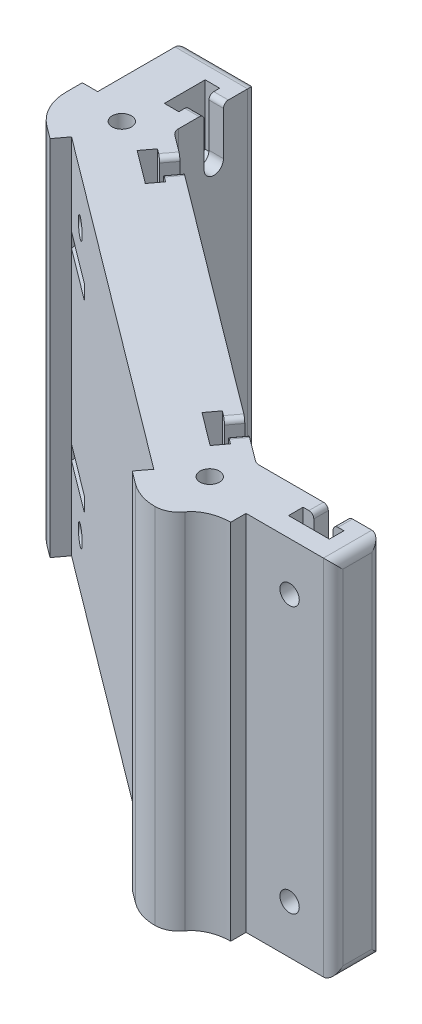
from build123d import *

# Parameters (mm, degrees)
BOSS_EXTRUDE1_DEPTH = 75
SKETCH2_R           = 2
CUT_EXTRUDE1_DEPTH  = 10
SKETCH3_R           = 2
CUT_EXTRUDE2_DEPTH  = 15
SKETCH4_R           = 2
CUT_EXTRUDE3_DEPTH  = 15
CUT_EXTRUDE5_START  = -3
CUT_EXTRUDE5_DEPTH  = 3
CUT_EXTRUDE6_START  = -3
CUT_EXTRUDE6_DEPTH  = 3
CUT_EXTRUDE7_START  = -3
CUT_EXTRUDE7_DEPTH  = 3
CUT_EXTRUDE8_START  = -3
CUT_EXTRUDE8_DEPTH  = 3
CUT_EXTRUDE9_START  = -3
CUT_EXTRUDE9_DEPTH  = 3
SKETCH5_R           = 2
CUT_EXTRUDE4_DEPTH  = 75
CUT_EXTRUDE10_START = -3
CUT_EXTRUDE10_DEPTH = 3
FILLET1_R           = 1
FILLET2_R           = 2
CUT_EXTRUDE11_START = -17
CUT_EXTRUDE11_DEPTH = 3


with BuildPart() as part:
    # Sketch1 → Boss-Extrude1 (new body)
    with BuildSketch(Plane(origin=(0, 0, 0), x_dir=(1, 0, 0), z_dir=(0, 1, 0))):
        with BuildLine():
            Line((-18.028333333, 23.74), (2.725, 8.175))
            Line((2.725, 8.175), (28.666666667, 8.175))
            Line((28.666666667, 8.175), (28.666666667, -1.825))
            Line((28.666666667, -1.825), (10.666666667, -1.825))
            Line((10.666666667, -1.825), (10.666666667, -5))
            add(Edge.make_bspline(
                [(10.666666667, -5), (6.082964765, -5), (4.109838042, -7.8476712)],
                knots=[4.71238898, 4.71238898, 4.71238898, 5.838176577, 5.838176577, 5.838176577], degree=2, weights=[1, 0.84571442, 1]))
            ThreePointArc((4.109838042, -7.8476712), (2.319659889, -9.429354129), (0, -10))
            ThreePointArc((0, -10), (-3.16227766, -9.486832981), (-6, -8))
            Line((-6, -8), (-8.666666667, -6))
            Line((-8.666666667, -6), (-6.761666667, -3.46))
            Line((-6.761666667, -3.46), (-74.761666667, 47.54))
            Line((-74.761666667, 47.54), (-76.666666667, 45))
            Line((-76.666666667, 45), (-79.333333333, 47))
            ThreePointArc((-79.333333333, 47), (-82.277605243, 50.527864045), (-83.333333333, 55))
            Line((-83.333333333, 55), (-83.333333333, 58.333333333))
            Line((-83.333333333, 58.333333333), (-80.158333333, 58.333333333))
            Line((-80.158333333, 58.333333333), (-80.158333333, 76.333333333))
            Line((-80.158333333, 76.333333333), (-65.158333333, 76.333333333))
            Line((-65.158333333, 76.333333333), (-65.158333333, 59.0875))
            Line((-65.158333333, 59.0875), (-51.361666667, 48.74))
            Line((-51.361666667, 48.74), (-18.028333333, 23.74))
        make_face()
    extrude(amount=BOSS_EXTRUDE1_DEPTH)

    # Sketch2 → Cut-Extrude1 (cut)
    with BuildSketch(Plane.XY.offset(1.825)):
        with Locations((19.666666667, 10)):
            Circle(SKETCH2_R)
        with Locations((19.666666667, 65)):
            Circle(SKETCH2_R)
    extrude(amount=-CUT_EXTRUDE1_DEPTH, mode=Mode.SUBTRACT)

    # Sketch3 → Cut-Extrude2 (cut)
    with BuildSketch(Plane(origin=(-4.095, 0, 5.46), x_dir=(0.8000000000000002, 0, 0.5999999999999999), z_dir=(-0.5999999999999999, 0, 0.8000000000000003))):
        with Locations((-12.333333333, 10)):
            Circle(SKETCH3_R)
        with Locations((-12.333333333, 65)):
            Circle(SKETCH3_R)
        with Locations((-79.333333333, 10)):
            Circle(SKETCH3_R)
        with Locations((-79.333333333, 65)):
            Circle(SKETCH3_R)
    extrude(amount=-CUT_EXTRUDE2_DEPTH, mode=Mode.SUBTRACT)

    # Sketch4 → Cut-Extrude3 (cut)
    with BuildSketch(Plane.ZY.offset(80.158333333)):
        with Locations((-67.333333333, 10)):
            Circle(SKETCH4_R)
        with Locations((-67.333333333, 65)):
            Circle(SKETCH4_R)
    extrude(amount=-CUT_EXTRUDE3_DEPTH, mode=Mode.SUBTRACT)

    # Sketch6 → Cut-Extrude5 (cut)
    with BuildSketch(Plane(origin=(4.905, 0, -6.54), x_dir=(-0.8000000000000002, 0, -0.6), z_dir=(0.6, 0, -0.8000000000000002)).offset(CUT_EXTRUDE5_START)):
        Polygon((8.114583333, 62.564303552), (12.333333333, 60.128607104), (16.552083333, 62.564303552), (16.552083333, 75), (8.114583333, 75), align=None)
        Polygon((75.114583333, 62.564303552), (79.333333333, 60.128607104), (83.552083333, 62.564303552), (83.552083333, 75), (75.114583333, 75), align=None)
        Polygon((8.114583333, 12.435696448), (12.333333333, 14.871392896), (16.552083333, 12.435696448), (16.552083333, 0), (8.114583333, 0), align=None)
        Polygon((75.114583333, 12.435696448), (79.333333333, 14.871392896), (83.552083333, 12.435696448), (83.552083333, 0), (75.114583333, 0), align=None)
    extrude(amount=-CUT_EXTRUDE5_DEPTH, mode=Mode.SUBTRACT)

    # Sketch7 → Cut-Extrude6 (cut)
    with BuildSketch(Plane(origin=(4.905, 0, -6.54), x_dir=(-0.8000000000000002, 0, -0.6), z_dir=(0.6, 0, -0.8000000000000002)).offset(CUT_EXTRUDE6_START)):
        with BuildLine():
            Line((14.333333333, 65), (14.333333333, 75))
            Line((14.333333333, 75), (10.333333333, 75))
            Line((10.333333333, 75), (10.333333333, 65))
            ThreePointArc((10.333333333, 65), (12.333333333, 67), (14.333333333, 65))
        make_face()
        with BuildLine():
            Line((81.333333333, 65), (81.333333333, 75))
            Line((81.333333333, 75), (77.333333333, 75))
            Line((77.333333333, 75), (77.333333333, 65))
            ThreePointArc((77.333333333, 65), (79.333333333, 67), (81.333333333, 65))
        make_face()
        with BuildLine():
            Line((81.333333333, 0), (77.333333333, 0))
            Line((77.333333333, 0), (77.333333333, 10))
            ThreePointArc((77.333333333, 10), (79.333333333, 8), (81.333333333, 10))
            Line((81.333333333, 10), (81.333333333, 0))
        make_face()
        with BuildLine():
            Line((14.333333333, 0), (10.333333333, 0))
            Line((10.333333333, 0), (10.333333333, 10))
            ThreePointArc((10.333333333, 10), (12.333333333, 8), (14.333333333, 10))
            Line((14.333333333, 10), (14.333333333, 0))
        make_face()
    extrude(amount=CUT_EXTRUDE6_DEPTH, mode=Mode.SUBTRACT)

    # Sketch8 → Cut-Extrude7 (cut)
    with BuildSketch(Plane(origin=(0, 0, -8.175), x_dir=(-1, 0, 0), z_dir=(0, 0, -1)).offset(CUT_EXTRUDE7_START)):
        Polygon((-23.885416667, 0), (-23.885416667, 12.435696448), (-19.666666667, 14.871392896), (-15.447916667, 12.435696448), (-15.447916667, 0), align=None)
        Polygon((-23.885416667, 62.564303552), (-19.666666667, 60.128607104), (-15.447916667, 62.564303552), (-15.447916667, 75), (-23.885416667, 75), align=None)
    extrude(amount=-CUT_EXTRUDE7_DEPTH, mode=Mode.SUBTRACT)

    # Sketch9 → Cut-Extrude8 (cut)
    with BuildSketch(Plane(origin=(0, 0, -8.175), x_dir=(-1, 0, 0), z_dir=(0, 0, -1)).offset(CUT_EXTRUDE8_START)):
        with BuildLine():
            Line((-17.666666667, 65), (-17.666666667, 75))
            Line((-17.666666667, 75), (-21.666666667, 75))
            Line((-21.666666667, 75), (-21.666666667, 65))
            ThreePointArc((-21.666666667, 65), (-19.666666667, 67), (-17.666666667, 65))
        make_face()
        with BuildLine():
            Line((-21.666666667, 10), (-21.666666667, 0))
            Line((-21.666666667, 0), (-17.666666667, 0))
            Line((-17.666666667, 0), (-17.666666667, 10))
            ThreePointArc((-17.666666667, 10), (-19.666666667, 8), (-21.666666667, 10))
        make_face()
    extrude(amount=CUT_EXTRUDE8_DEPTH, mode=Mode.SUBTRACT)

    # Sketch10 → Cut-Extrude9 (cut)
    with BuildSketch(Plane(origin=(-65.158333333, 0, 0), x_dir=(0, 0, -1), z_dir=(1, 0, 0)).offset(CUT_EXTRUDE9_START)):
        Polygon((63.114583333, 62.564303552), (67.333333333, 60.128607104), (71.552083333, 62.564303552), (71.552083333, 75), (63.114583333, 75), align=None)
        Polygon((63.114583333, 12.435696448), (67.333333333, 14.871392896), (71.552083333, 12.435696448), (71.552083333, 0), (63.114583333, 0), align=None)
    extrude(amount=-CUT_EXTRUDE9_DEPTH, mode=Mode.SUBTRACT)

    # Sketch5 → Cut-Extrude4 (cut)
    with BuildSketch(Plane(origin=(0, 75, 0), x_dir=(1, 0, 0), z_dir=(0, 1, 0))):
        with Locations(Location((0.333333333, 1, 0), (0, 0, 270))):
            Circle(SKETCH5_R)
        with Locations(Location((-72.333333333, 55.5, 0), (0, 0, 270))):
            Circle(SKETCH5_R)
    extrude(amount=-CUT_EXTRUDE4_DEPTH, mode=Mode.SUBTRACT)

    # Sketch11 → Cut-Extrude10 (cut)
    with BuildSketch(Plane(origin=(-65.158333333, 0, 0), x_dir=(0, 0, -1), z_dir=(1, 0, 0)).offset(CUT_EXTRUDE10_START)):
        with BuildLine():
            Line((69.333333333, 65), (69.333333333, 75))
            Line((69.333333333, 75), (65.333333333, 75))
            Line((65.333333333, 75), (65.333333333, 65))
            ThreePointArc((65.333333333, 65), (67.333333333, 67), (69.333333333, 65))
        make_face()
        with BuildLine():
            Line((69.333333333, 10), (69.333333333, 0))
            Line((69.333333333, 0), (65.333333333, 0))
            Line((65.333333333, 0), (65.333333333, 10))
            ThreePointArc((65.333333333, 10), (67.333333333, 8), (69.333333333, 10))
        make_face()
    extrude(amount=CUT_EXTRUDE10_DEPTH, mode=Mode.SUBTRACT)

    # Fillet1
    fillet1_edges = [part.edges().sort_by_distance(p)[0] for p in [
        (-7.461666667, 0, -13.94),
        (-4.261666667, 0, -11.54),
        (-61.061666667, 0, -54.14),
        (-57.861666667, 0, -51.74),
        (-57.861666667, 75, -51.74),
        (-61.061666667, 75, -54.14),
        (-4.261666667, 75, -11.54),
        (-7.461666667, 75, -13.94),
        (21.666666667, 75, -6.675),
        (17.666666667, 75, -6.675),
        (17.666666667, 0, -6.675),
        (21.666666667, 0, -6.675),
        (-66.658333333, 75, -65.333333333),
        (-66.658333333, 75, -69.333333333),
        (-66.658333333, 0, -69.333333333),
        (-66.658333333, 0, -65.333333333),
    ]]
    fillet(fillet1_edges, radius=FILLET1_R)

    # Fillet2
    fillet2_edges = [part.edges().sort_by_distance(p)[0] for p in [
        (28.666666667, 75, -3.175),
        (-72.658333333, 0, -76.333333333),
        (28.666666667, 0, -3.175),
        (-80.158333333, 37.5, -76.333333333),
        (-65.158333333, 37.5, -76.333333333),
        (-65.158333333, 37.5, -59.0875),
        (2.725, 37.5, -8.175),
        (28.666666667, 37.5, -8.175),
        (28.666666667, 37.5, 1.825),
        (-72.658333333, 75, -76.333333333),
    ]]
    fillet(fillet2_edges, radius=FILLET2_R)

    # Sketch12 → Cut-Extrude11 (cut)
    with BuildSketch(Plane(origin=(0, 75, 0), x_dir=(1, 0, 0), z_dir=(0, 1, 0)).offset(CUT_EXTRUDE11_START)):
        Polygon((5.201967965, 1.163907213), (2.625702839, 5.298314879), (-2.242931793, 5.134407666), (-17.534471272, 4.619603454), (-6.761666667, -3.46), (-1.959036172, -3.298314879), (2.909598459, -3.134407666), align=None)
        Polygon((-67.662683304, 54.115985169), (-68.799416316, 58.852894162), (-73.470066345, 60.236908993), (-77.003983363, 56.884014831), (-75.867250351, 52.147105838), (-74.761666667, 47.54), (-64.180158859, 39.603869144), align=None)
    cut_extrude11 = extrude(amount=-CUT_EXTRUDE11_DEPTH, mode=Mode.SUBTRACT)

    # Mirror1: Cut-Extrude11 across plane
    add(cut_extrude11.mirror(Plane.ZX.offset(37.5)), mode=Mode.SUBTRACT)


solid = part.part
